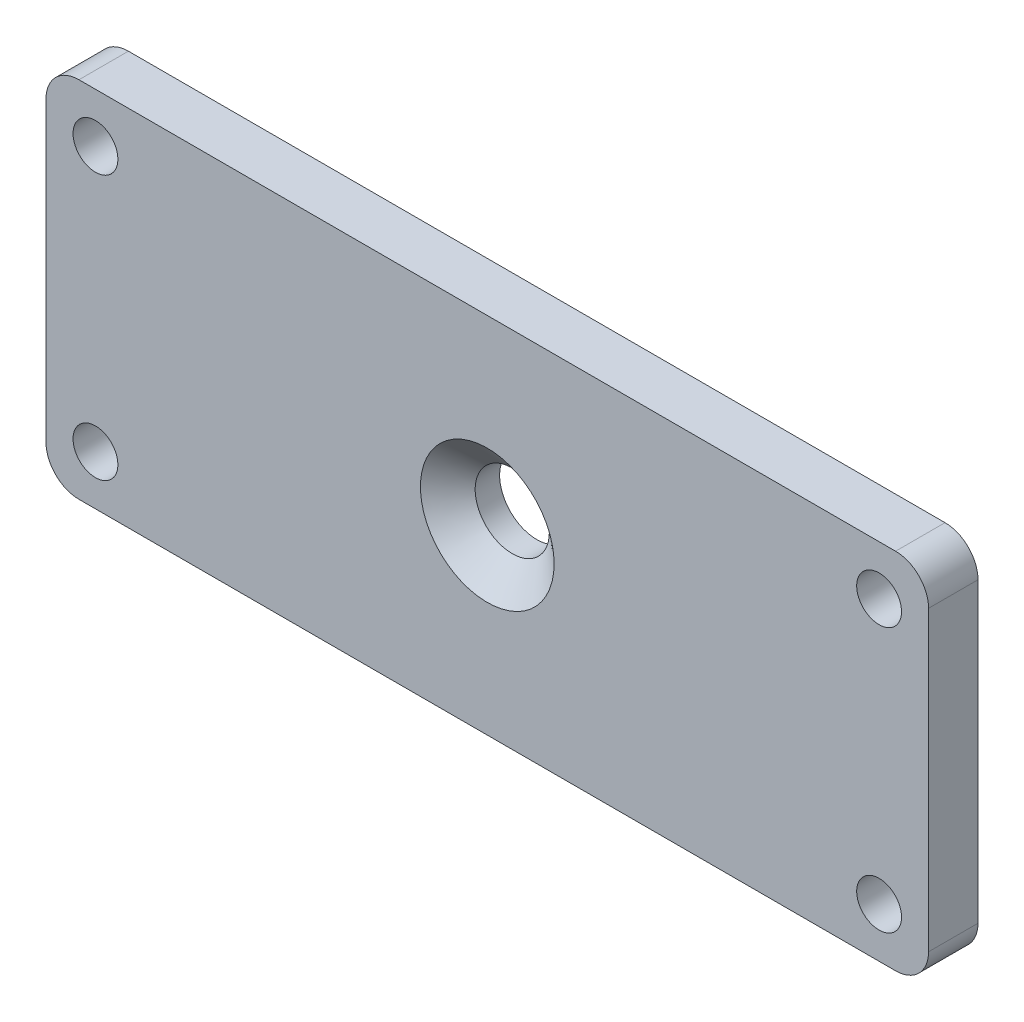
from build123d import *

# Parameters (mm, degrees)
SKETCH1_W           = 85
SKETCH1_H           = 4.7625
BOSS_EXTRUDE1_DEPTH = 17.5
FILLET1_R           = 3.175
SKETCH3_R           = 2.159
CUT_EXTRUDE3_DEPTH  = 10


with BuildPart() as part:
    # Sketch1 → Boss-Extrude1 (new, symmetric)
    with BuildSketch(Plane(origin=(0, 0, 0), x_dir=(1, 0, 0), z_dir=(0, 1, 0))):
        with Locations((0, 2.38125)):
            Rectangle(SKETCH1_W, SKETCH1_H)
    extrude(amount=BOSS_EXTRUDE1_DEPTH, both=True)

    # Fillet1
    fillet1_edges = [part.edges().sort_by_distance(p)[0] for p in [
        (42.5, 17.5, -2.38125),
        (42.5, -17.5, -2.38125),
        (-42.5, -17.5, -2.38125),
        (-42.5, 17.5, -2.38125),
    ]]
    fillet(fillet1_edges, radius=FILLET1_R)

    # Sketch3 → Cut-Extrude3 (cut)
    with BuildSketch(Plane.XY):
        with Locations((-37.7375, 12.7375)):
            Circle(SKETCH3_R)
        with Locations((-37.7375, -12.7375)):
            Circle(SKETCH3_R)
        with Locations((37.7375, 12.7375)):
            Circle(SKETCH3_R)
        with Locations((37.7375, -12.7375)):
            Circle(SKETCH3_R)
    extrude(amount=-CUT_EXTRUDE3_DEPTH, mode=Mode.SUBTRACT)

    # Sketch9 → CSK for 1/4 Flat Head Machine Screw (100)1 (revolve, cut)
    with BuildSketch(Plane(origin=(0, 0, 0), x_dir=(0, -1, 0), z_dir=(1, 0, 0))):
        Polygon((0, 0), (0, 4.7625), (3.57124, 4.7625), (3.57124, 2.406252448), (6.4389, 0), align=None)
    revolve(axis=Axis((0, 0, 6.35), (0, 0, -1)), mode=Mode.SUBTRACT)


solid = part.part
